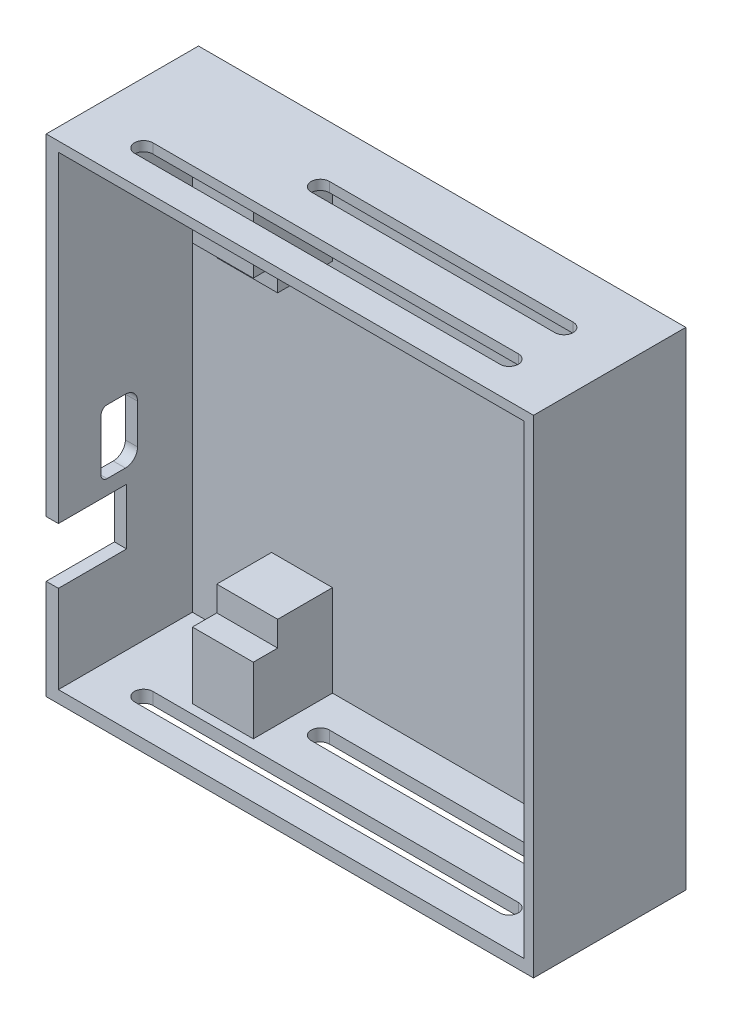
from build123d import *

# Parameters (mm, degrees)
ESQUISSE1_W             = 80
ESQUISSE1_H             = 80
BOSS_EXTRU_1_DEPTH      = 25
ESQUISSE2_W             = 76.4
ESQUISSE2_H             = 76.4
ENL_V_MAT_EXTRU_3_DEPTH = 22
ESQUISSE3_W             = 10
ESQUISSE3_H             = 15
ESQUISSE3_H_2           = 10
BOSS_EXTRU_2_DEPTH      = 9
ESQUISSE4_W             = 10
ESQUISSE4_H             = 10.9
ESQUISSE4_W_2           = 6
ESQUISSE4_H_2           = 10
BOSS_EXTRU_3_DEPTH      = 4
ESQUISSE5_W             = 11.2
ESQUISSE5_H             = 9.2
ESQUISSE5_W_2           = 6
ESQUISSE5_H_2           = 10.5
ENL_V_MAT_EXTRU_4_DEPTH = 10
CONG_2_R                = 2
CONG_3_R                = 1
ENL_V_MAT_EXTRU_5_DEPTH = 0.5
ENL_V_MAT_EXTRU_6_DEPTH = 0.5
ENL_V_MAT_EXTRU_7_DEPTH = 2
ENL_V_START             = -2
ENL_V_MAT_EXTRU_8_DEPTH = 2


with BuildPart() as part:
    # Esquisse1 → Boss.-Extru.1 (new body)
    with BuildSketch(Plane.XY):
        with Locations((40, 40)):
            Rectangle(ESQUISSE1_W, ESQUISSE1_H)
    extrude(amount=BOSS_EXTRU_1_DEPTH)

    # Esquisse2 → Enlèv. mat.-Extru.3 (cut)
    with BuildSketch(Plane.XY.offset(25)):
        with Locations((40.2, 40.2)):
            Rectangle(ESQUISSE2_W, ESQUISSE2_H)
    extrude(amount=-ENL_V_MAT_EXTRU_3_DEPTH, mode=Mode.SUBTRACT)

    # Esquisse3 → Boss.-Extru.2 (add)
    with BuildSketch(Plane.XY.offset(3)):
        with Locations((20, 9.5)):
            Rectangle(ESQUISSE3_W, ESQUISSE3_H)
        with Locations((73.4, 39.688534772)):
            Rectangle(ESQUISSE3_W, ESQUISSE3_H_2)
        with Locations((20, 70.9)):
            Rectangle(ESQUISSE3_W, ESQUISSE3_H)
    extrude(amount=BOSS_EXTRU_2_DEPTH)

    # Esquisse4 → Boss.-Extru.3 (add)
    with BuildSketch(Plane.XY.offset(12)):
        with Locations((20, 7.45)):
            Rectangle(ESQUISSE4_W, ESQUISSE4_H)
        with Locations((20, 72.95)):
            Rectangle(ESQUISSE4_W, ESQUISSE4_H)
        with Locations((75.4, 39.688534772)):
            Rectangle(ESQUISSE4_W_2, ESQUISSE4_H_2)
    extrude(amount=BOSS_EXTRU_3_DEPTH)

    # Esquisse5 → Enlèv. mat.-Extru.4 (cut)
    with BuildSketch(Plane.ZY):
        with Locations((19.4, 21)):
            Rectangle(ESQUISSE5_W, ESQUISSE5_H)
        with Locations((15, 33.25)):
            Rectangle(ESQUISSE5_W_2, ESQUISSE5_H_2)
    extrude(amount=-ENL_V_MAT_EXTRU_4_DEPTH, mode=Mode.SUBTRACT)

    # Congé2
    cong_2_edges = [part.edges().sort_by_distance(p)[0] for p in [
        (1, 28, 12),
        (1, 38.5, 12),
    ]]
    fillet(cong_2_edges, radius=CONG_2_R)

    # Congé3
    cong_3_edges = [part.edges().sort_by_distance(p)[0] for p in [
        (1, 38.5, 18),
        (1, 28, 18),
    ]]
    fillet(cong_3_edges, radius=CONG_3_R)

    # Esquisse8 → Enlèv. mat.-Extru.5 (cut)
    with BuildSketch(Plane.ZY):
        with BuildLine():
            add(Edge.make_bspline(
                [(7.313237468, 65.833159363), (7.48897389, 65.712447359), (7.804126252, 65.49597161), (8.487346274, 65.283616184), (8.981094379, 65.226001547), (9.307707678, 65.18788959)],
                knots=[0, 0, 0, 0, 0.299076085, 0.536340353, 1, 1, 1, 1], degree=3))
            add(Edge.make_bspline(
                [(7.284702647, 65.80245585), (7.293856567, 65.81317431), (7.303547017, 65.823166837), (7.313237468, 65.833159363)],
                knots=[0.816445355, 0.816445355, 0.816445355, 0.816445355, 1, 1, 1, 1], degree=3))
            add(Edge.make_bspline(
                [(17.901527847, 50.874632789), (17.356129628, 51.530826995), (16.293469748, 52.809362994), (15.275532925, 55.228252674), (13.933854466, 57.885340246), (11.93358483, 60.745765414), (9.727873266, 63.52670077), (8.030552607, 65.116137898), (7.284702647, 65.80245585)],
                knots=[0, 0, 0, 0, 0.134488449, 0.262038771, 0.413324325, 0.606278792, 0.814215894, 0.974718857, 0.974718857, 0.974718857, 0.974718857], degree=3))
            add(Edge.make_bspline(
                [(7.407085151, 65.469076199), (7.997724667, 64.952415937), (9.572762834, 63.532102924), (11.741354127, 60.845320938), (13.846315376, 57.844082794), (15.265007359, 55.100127721), (16.333677342, 52.722721211), (17.367018575, 51.504680356), (17.901527847, 50.874632789)],
                knots=[0.043476968, 0.043476968, 0.043476968, 0.043476968, 0.167785205, 0.379770977, 0.589080615, 0.748039182, 0.869669971, 1, 1, 1, 1], degree=3))
            add(Edge.make_bspline(
                [(7.987837686, 63.516054267), (7.933705658, 63.852405499), (7.85098554, 64.366389832), (7.741769984, 65.069503506), (7.523361561, 65.343113704), (7.407085151, 65.469076199)],
                knots=[0, 0, 0, 0, 0.449393835, 0.686726756, 0.906490115, 0.906490115, 0.906490115, 0.906490115], degree=3))
            add(Edge.make_bspline(
                [(9.581947331, 60.333994368), (9.35896114, 60.695257019), (8.925646923, 61.397274669), (8.371533969, 62.453225866), (8.111622296, 63.17317422), (7.987837686, 63.516054267)],
                knots=[0, 0, 0, 0, 0.357022344, 0.693777745, 1, 1, 1, 1], degree=3))
            add(Edge.make_bspline(
                [(9.923647007, 61.990871165), (9.797152593, 61.702831345), (9.59150409, 61.234550131), (9.533644523, 60.653068807), (9.572467818, 60.3966133), (9.581947331, 60.333994368)],
                knots=[0, 0, 0, 0, 0.547075637, 0.889409121, 1, 1, 1, 1], degree=3))
            add(Edge.make_bspline(
                [(9.845334721, 59.996400955), (9.811598018, 60.115915835), (9.717723572, 60.448473327), (9.824688072, 61.125443291), (9.886572886, 61.666645995), (9.923647007, 61.990871165)],
                knots=[0, 0, 0, 0, 0.183614026, 0.510917298, 1, 1, 1, 1], degree=3))
            add(Edge.make_bspline(
                [(12.516751585, 56.360012475), (12.220146813, 56.731946706), (11.602008437, 57.507075242), (10.696458869, 58.709807691), (10.128597293, 59.568209935), (9.845334721, 59.996400955)],
                knots=[0, 0, 0, 0, 0.316155138, 0.658882265, 1, 1, 1, 1], degree=3))
            add(Edge.make_bspline(
                [(12.5243775, 58.549530139), (12.475747631, 58.195383202), (12.389698733, 57.568732254), (12.460969789, 56.835777723), (12.504804941, 56.461905897), (12.516751585, 56.360012475)],
                knots=[0, 0, 0, 0, 0.485970736, 0.859908672, 1, 1, 1, 1], degree=3))
            add(Edge.make_bspline(
                [(12.712972257, 56.117743005), (12.689100366, 56.22919998), (12.605595842, 56.619079516), (12.538586692, 57.433441747), (12.529671109, 58.133733427), (12.5243775, 58.549530139)],
                knots=[0, 0, 0, 0, 0.139880518, 0.489305866, 1, 1, 1, 1], degree=3))
            add(Edge.make_bspline(
                [(13.853926539, 54.716920987), (13.770782279, 54.821999659), (13.560207416, 55.088126596), (13.175056735, 55.551153097), (12.879119476, 55.914019785), (12.712972257, 56.117743005)],
                knots=[0, 0, 0, 0, 0.222488299, 0.563483801, 1, 1, 1, 1], degree=3))
            add(Edge.make_bspline(
                [(18.605458509, 50.170702126), (18.280931893, 50.44303874), (17.255771256, 51.303334203), (15.614574097, 52.765406202), (14.427661827, 54.080988547), (13.853926539, 54.716920987)],
                knots=[0, 0, 0, 0, 0.193087, 0.609950563, 1, 1, 1, 1], degree=3))
            add(Edge.make_bspline(
                [(16.20036208, 54.159642546), (16.438779976, 53.603827531), (16.879859527, 52.575554733), (17.742560122, 51.269607993), (18.332407028, 50.518434698), (18.605458509, 50.170702126)],
                knots=[0, 0, 0, 0, 0.387194684, 0.716320628, 1, 1, 1, 1], degree=3))
            add(Edge.make_bspline(
                [(13.443300319, 61.775879008), (13.77418719, 60.915642263), (14.463863001, 59.122629222), (15.329762312, 56.564659638), (15.935132531, 54.892334677), (16.20036208, 54.159642546)],
                knots=[0, 0, 0, 0, 0.341315206, 0.711411851, 1, 1, 1, 1], degree=3))
            add(Edge.make_bspline(
                [(11.976778106, 61.384610882), (12.233772331, 61.501042009), (12.640271025, 61.685206075), (13.157414565, 61.862407498), (13.381058534, 61.794717609), (13.443300319, 61.775879008)],
                knots=[0, 0, 0, 0, 0.553685075, 0.875787227, 1, 1, 1, 1], degree=3))
            add(Edge.make_bspline(
                [(13.279343135, 62.10408668), (13.23692898, 62.085588167), (13.051332425, 62.004642073), (12.566317448, 61.865427123), (12.210103671, 61.574906445), (11.976778106, 61.384610882)],
                knots=[0, 0, 0, 0, 0.092717793, 0.405716039, 1, 1, 1, 1], degree=3))
            add(Edge.make_bspline(
                [(13.003343655, 62.694801827), (13.032902353, 62.635423942), (13.094815074, 62.511052886), (13.186462069, 62.313925775), (13.247594869, 62.175813112), (13.279343135, 62.10408668)],
                knots=[0, 0, 0, 0, 0.305139846, 0.639136348, 1, 1, 1, 1], degree=3))
            add(Edge.make_bspline(
                [(9.307707678, 65.18788959), (9.767844099, 65.137295561), (10.719249787, 65.03268431), (12.109364501, 64.17933924), (12.684347555, 63.224525191), (13.003343655, 62.694801827)],
                knots=[0, 0, 0, 0, 0.294280708, 0.608472459, 1, 1, 1, 1], degree=3))
        make_face()
    extrude(amount=-ENL_V_MAT_EXTRU_5_DEPTH, mode=Mode.SUBTRACT)

    # Esquisse11 → Enlèv. mat.-Extru.6 (cut)
    with BuildSketch(Plane.ZY):
        with BuildLine():
            add(Edge.make_bspline(
                [(7.243895568, 65.607536557), (7.235472734, 65.629492421), (7.214919328, 65.683069137), (7.244525992, 65.745776075), (7.269630044, 65.777003976), (7.274021635, 65.782146154)],
                knots=[0, 0, 0, 0, 0.298493917, 0.728385063, 0.816445355, 0.816445355, 0.816445355, 0.816445355], degree=3))
            add(Edge.make_bspline(
                [(7.274021635, 65.782146154), (7.156541314, 65.890249469), (7.038900997, 65.998201789), (6.921260681, 66.10615411)],
                knots=[0.974718857, 0.974718857, 0.974718857, 0.974718857, 1, 1, 1, 1], degree=3))
            add(Edge.make_bspline(
                [(6.921260681, 66.10615411), (6.831714942, 66.177342754), (6.574667912, 66.381694519), (6.223380928, 66.669125539), (5.956637647, 66.879112302), (5.858032076, 66.956736993)],
                knots=[0, 0, 0, 0, 0.25204317, 0.723506773, 1, 1, 1, 1], degree=3))
            add(Edge.make_bspline(
                [(5.858032076, 66.956736993), (5.873494425, 66.928903501), (5.924043753, 66.837910578), (6.022316687, 66.682245025), (6.087700791, 66.544864522), (6.122006074, 66.472784663)],
                knots=[0, 0, 0, 0, 0.173191566, 0.566195825, 1, 1, 1, 1], degree=3))
            add(Edge.make_bspline(
                [(6.122006074, 66.472784663), (6.149493678, 66.44984741), (6.251171186, 66.365001792), (6.467685513, 66.201886466), (6.660833558, 66.067810503), (6.774608459, 65.988832333)],
                knots=[0, 0, 0, 0, 0.132137543, 0.488780926, 1, 1, 1, 1], degree=3))
            add(Edge.make_bspline(
                [(6.774608459, 65.988832333), (6.982217829, 65.809150718), (7.189827198, 65.629469103), (7.396404139, 65.448766503)],
                knots=[0, 0, 0, 0, 0.043476968, 0.043476968, 0.043476968, 0.043476968], degree=3))
            add(Edge.make_bspline(
                [(7.396404139, 65.448766503), (7.346928222, 65.502363874), (7.295411895, 65.554950216), (7.243895568, 65.607536557)],
                knots=[0.906490115, 0.906490115, 0.906490115, 0.906490115, 1, 1, 1, 1], degree=3))
        make_face()
    extrude(amount=-ENL_V_MAT_EXTRU_6_DEPTH, mode=Mode.SUBTRACT)

    # Esquisse12 → Enlèv. mat.-Extru.7 (cut)
    with BuildSketch(Plane(origin=(0, 0, 0), x_dir=(-1, 0, 0), z_dir=(0, -1, 0))):
        with BuildLine():
            Line((-10, -20.5), (-70, -20.5))
            ThreePointArc((-70, -20.5), (-71.5, -19), (-70, -17.5))
            Line((-70, -17.5), (-10, -17.5))
            ThreePointArc((-10, -17.5), (-8.5, -19), (-10, -20.5))
        make_face()
        with BuildLine():
            Line((-70, -8.5), (-30, -8.5))
            ThreePointArc((-30, -8.5), (-28.5, -10), (-30, -11.5))
            Line((-30, -11.5), (-70, -11.5))
            ThreePointArc((-70, -11.5), (-71.5, -10), (-70, -8.5))
        make_face()
    extrude(amount=-ENL_V_MAT_EXTRU_7_DEPTH, mode=Mode.SUBTRACT)

    # Esquisse14 → Enlèv. mat.-Extru.8 (cut)
    with BuildSketch(Plane(origin=(0, 80, 0), x_dir=(1, 0, 0), z_dir=(0, 1, 0)).offset(ENL_V_START)):
        with BuildLine():
            Line((70, -20.5), (10, -20.5))
            ThreePointArc((10, -20.5), (8.5, -19), (10, -17.5))
            Line((10, -17.5), (70, -17.5))
            ThreePointArc((70, -17.5), (71.5, -19), (70, -20.5))
        make_face()
        with BuildLine():
            Line((70, -11.5), (30, -11.5))
            ThreePointArc((30, -11.5), (28.5, -10), (30, -8.5))
            Line((30, -8.5), (70, -8.5))
            ThreePointArc((70, -8.5), (71.5, -10), (70, -11.5))
        make_face()
    extrude(amount=ENL_V_MAT_EXTRU_8_DEPTH, mode=Mode.SUBTRACT)


solid = part.part
